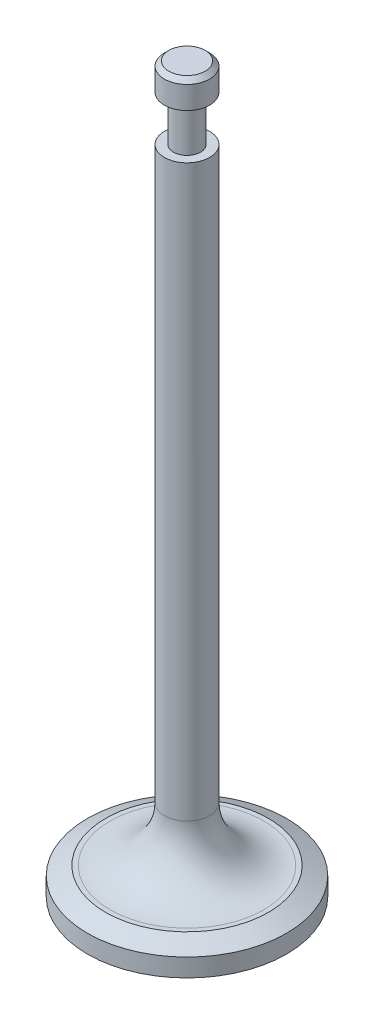
from build123d import *

# Parameters (mm, degrees)
FILLET1_R      = 6
CHAMFER1_SIZE  = 0.5
CHAMFER2_SIZE  = 2
CHAMFER2_SIZE2 = 1


with BuildPart() as part:
    # Sketch1 → Revolve1 (revolve)
    with BuildSketch(Plane.XY, mode=Mode.PRIVATE) as revolve1_sk:
        Polygon((0, 0), (0, 80), (2.5, 80), (2.5, 77), (1.5, 77), (1.5, 72), (2.5, 72), (2.5, 3), (11, 3), (11, 0), align=None)
    revolve(revolve1_sk.sketch.rotate(Axis((0, 0, 0), (0, 1, 0)), 90), axis=Axis((0, 0, 0), (0, 1, 0)))

    # Fillet1
    fillet1_edges = [part.edges().sort_by_distance(p)[0] for p in [
        (0, 3, 2.5),
    ]]
    fillet(fillet1_edges, radius=FILLET1_R)

    # Chamfer1
    chamfer1_edges = [part.edges().sort_by_distance(p)[0] for p in [
        (0, 80, 2.5),
    ]]
    chamfer(chamfer1_edges, length=CHAMFER1_SIZE)

    # Chamfer2
    chamfer2_edges = [part.edges().sort_by_distance(p)[0] for p in [
        (0, 3, 11),
    ]]
    chamfer2_side = [part.faces().sort_by_distance(p)[0] for p in [
        (0, 3, 8.811126984),
    ]]
    chamfer(chamfer2_edges, length=CHAMFER2_SIZE, length2=CHAMFER2_SIZE2, reference=chamfer2_side[0])


solid = part.part
